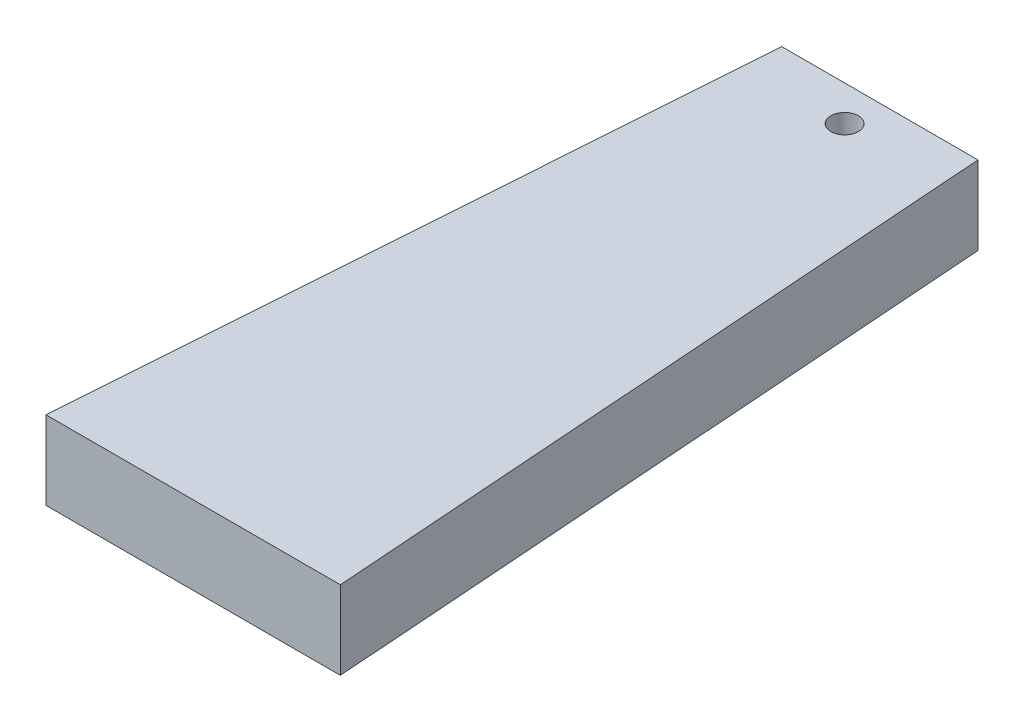
from build123d import *

# Parameters (mm, degrees)
SKETCH1_W           = 30
SKETCH1_H           = 8
BOSS_EXTRUDE1_DEPTH = 70
CUT_EXTRUDE1_DEPTH  = 70
SKETCH5_R           = 1.4
CUT_EXTRUDE3_DEPTH  = 100


with BuildPart() as part:
    # Sketch1 → Boss-Extrude1 (new body)
    with BuildSketch(Plane.XY):
        Rectangle(SKETCH1_W, SKETCH1_H)
    extrude(amount=BOSS_EXTRUDE1_DEPTH)

    # Sketch4 → Cut-Extrude1 (cut)
    with BuildSketch(Plane(origin=(0, 4, 0), x_dir=(1, 0, 0), z_dir=(0, 1, 0))):
        Polygon((-15, 0), (-10, 0), (-15, -70), align=None)
        Polygon((15, 0), (10, 0), (15, -70), align=None)
    extrude(amount=-CUT_EXTRUDE1_DEPTH, mode=Mode.SUBTRACT)

    # Sketch5 → Cut-Extrude3 (cut)
    with BuildSketch(Plane(origin=(0, 4, 0), x_dir=(1, 0, 0), z_dir=(0, 1, 0))):
        with Locations(Location((0, -3.6, 0), (0, 0, 180))):
            Circle(SKETCH5_R)
    extrude(amount=-CUT_EXTRUDE3_DEPTH, mode=Mode.SUBTRACT)


solid = part.part
